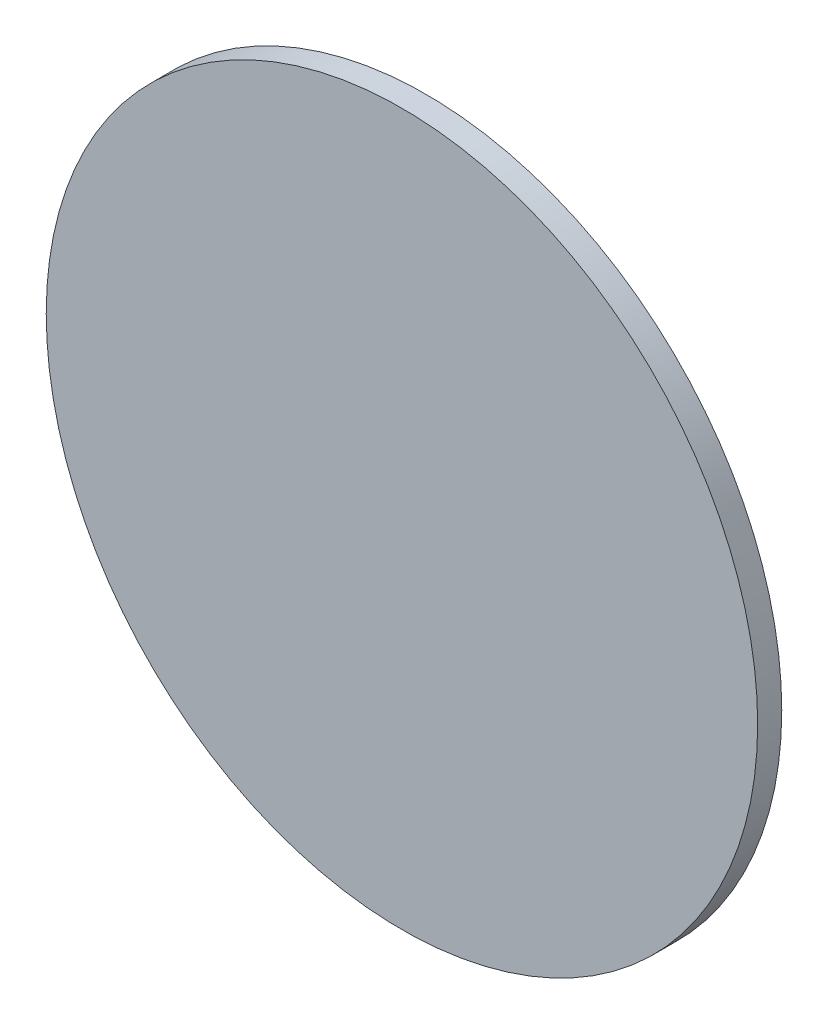
from build123d import *

# Parameters (mm, degrees)
CURVESKETCH_R   = 173.217
CURVEBOSS_DEPTH = 11.731


with BuildPart() as part:
    # CurveSketch → CurveBoss (new body)
    with BuildSketch(Plane.XY):
        with Locations((-3.719, 5.173)):
            Circle(CURVESKETCH_R)
    extrude(amount=CURVEBOSS_DEPTH)


solid = part.part
